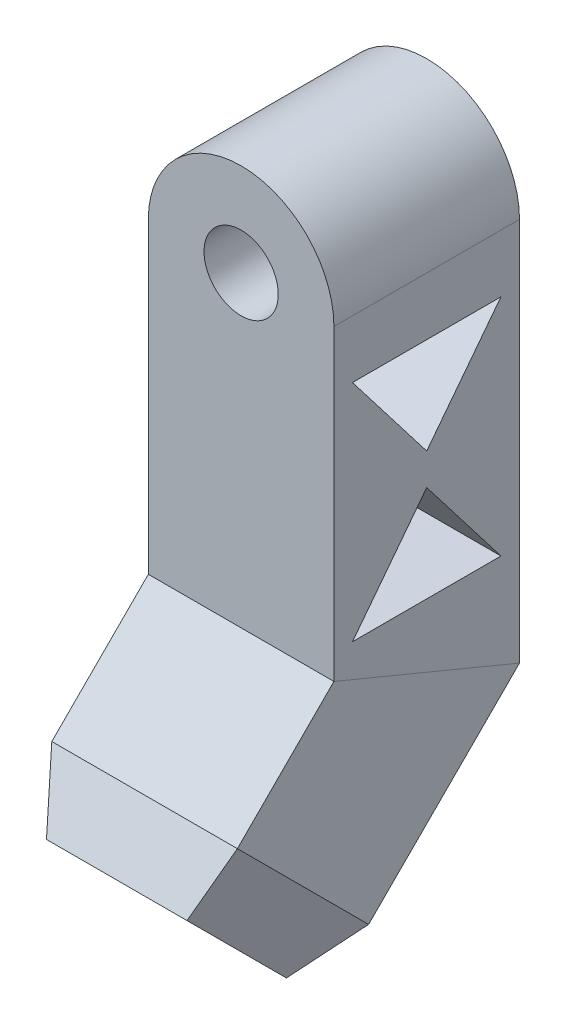
from build123d import *

# Parameters (mm, degrees)
SKETCH11_W          = 38.1
SKETCH11_H          = 38.1
SKETCH12_W          = 38.1
SKETCH12_H          = 38.1
BOSS_EXTRUDE5_DEPTH = 12.7
BOSS_EXTRUDE5_TAPER = 20
BOSS_EXTRUDE6_DEPTH = 38.1
SKETCH14_R          = 7.62
CUT_EXTRUDE2_DEPTH  = 38.1
SKETCH15_R          = 12.065
CUT_EXTRUDE3_DEPTH  = 12.7
CUT_EXTRUDE4_DEPTH  = 38.1


with BuildPart() as part:
    # Sweep1: sweep along a path in Sketch10
    with BuildLine(Plane(origin=(0, 0, 0), x_dir=(0, 0, -1), z_dir=(1, 0, 0))) as sweep1_path:
        Line((0, 96.393), (0, 25.4))
        Line((0, 25.4), (-25.4, 0))
    # Sketch11 → Sweep1 (sweep)
    with BuildSketch(Plane(origin=(0, 96.393, 0), x_dir=(1, 0, 0), z_dir=(0, 1, 0))):
        Rectangle(SKETCH11_W, SKETCH11_H)
    sweep(path=sweep1_path.line, transition=Transition.RIGHT)

    # Sketch12 → Boss-Extrude5 (add)
    with BuildSketch(Plane(origin=(0, -12.7, 12.7), x_dir=(1, 0, 0), z_dir=(0, -0.7071067811865461, 0.7071067811865489))):
        with Locations((0, 17.960512242)):
            Rectangle(SKETCH12_W, SKETCH12_H)
    extrude(amount=BOSS_EXTRUDE5_DEPTH, taper=BOSS_EXTRUDE5_TAPER)

    # Sketch13 → Boss-Extrude6 (add)
    with BuildSketch(Plane(origin=(0, 0, -19.05), x_dir=(-1, 0, 0), z_dir=(0, 0, -1))):
        with BuildLine():
            Line((-19.05, 96.393), (19.05, 96.393))
            ThreePointArc((19.05, 96.393), (0, 115.443), (-19.05, 96.393))
        make_face()
    extrude(amount=-BOSS_EXTRUDE6_DEPTH)

    # Sketch14 → Cut-Extrude2 (cut)
    with BuildSketch(Plane.XY.offset(19.05)):
        with Locations((0, 96.393)):
            Circle(SKETCH14_R)
    extrude(amount=-CUT_EXTRUDE2_DEPTH, mode=Mode.SUBTRACT)

    # Sketch15 → Cut-Extrude3 (cut)
    with BuildSketch(Plane(origin=(0, -21.680256121, 21.680256121), x_dir=(1, 0, 0), z_dir=(0, -0.7071067811865461, 0.7071067811865489))):
        with Locations(Location((0, 17.960512242, 0), (0, 0, 270))):
            Circle(SKETCH15_R)
    extrude(amount=-CUT_EXTRUDE3_DEPTH, mode=Mode.SUBTRACT)

    # Sketch16 → Cut-Extrude4 (cut)
    with BuildSketch(Plane.ZY.offset(19.05)):
        Polygon((-15.24, 38.445429874), (0, 58.232827541), (15.24, 38.445429874), align=None)
        Polygon((-15.24, 84.522903194), (15.24, 84.522903194), (0, 64.735505528), align=None)
    extrude(amount=-CUT_EXTRUDE4_DEPTH, mode=Mode.SUBTRACT)


solid = part.part
